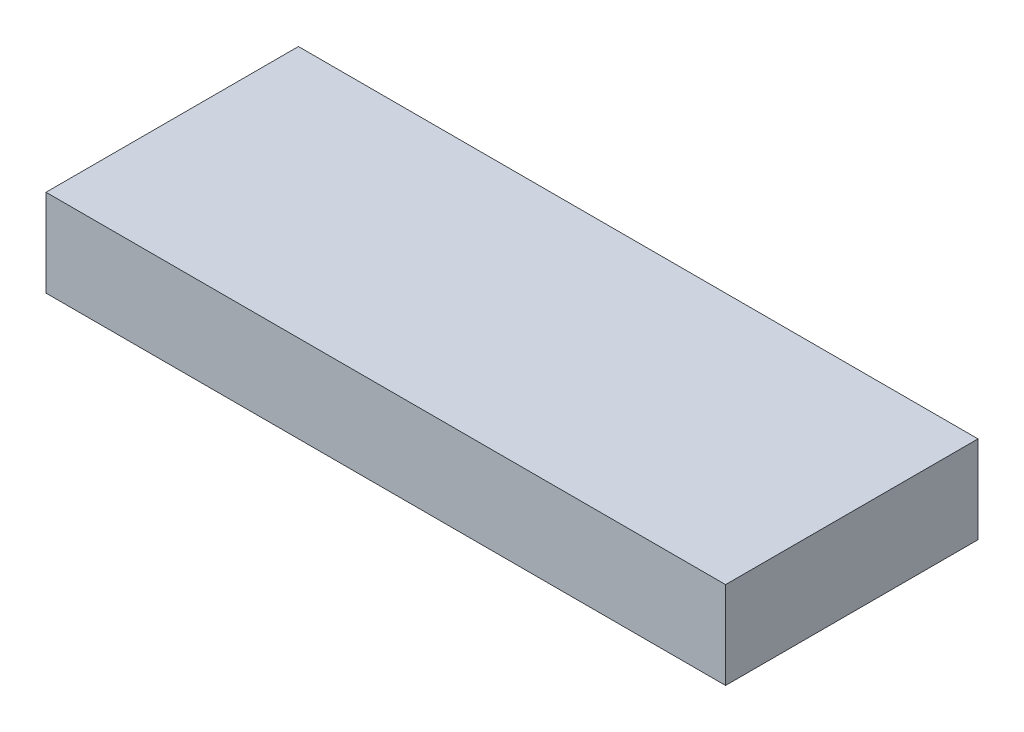
from build123d import *

# Parameters (mm, degrees)
SKETCH1_W           = 140
SKETCH1_H           = 52
BOSS_EXTRUDE1_DEPTH = 9


with BuildPart() as part:
    # Sketch1 → Boss-Extrude1 (new, symmetric)
    with BuildSketch(Plane(origin=(0, 0, 0), x_dir=(1, 0, 0), z_dir=(0, 1, 0))):
        Rectangle(SKETCH1_W, SKETCH1_H)
    extrude(amount=BOSS_EXTRUDE1_DEPTH, both=True)


solid = part.part
